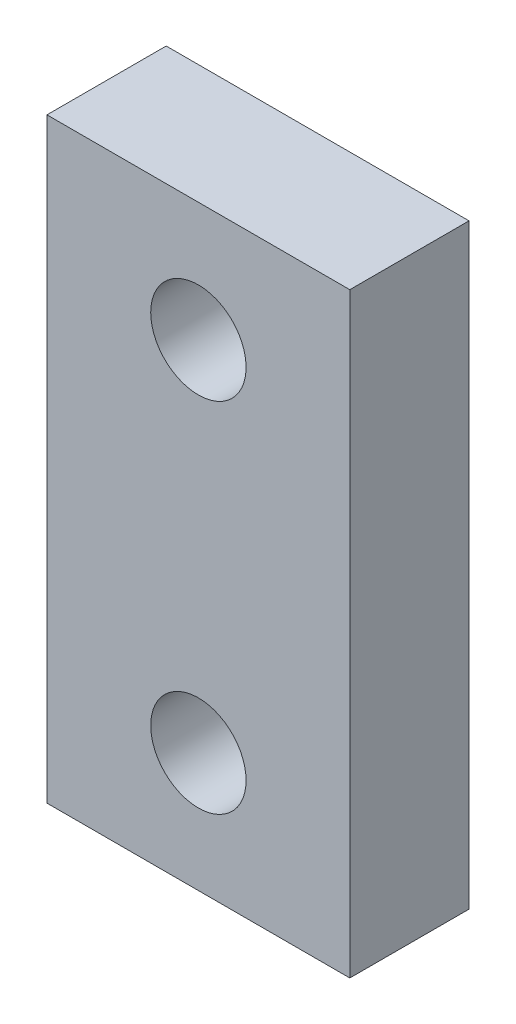
from build123d import *

# Parameters (mm, degrees)
SKETCH1_W           = 12.7
SKETCH1_H           = 25
SKETCH1_R           = 2
BOSS_EXTRUDE1_DEPTH = 5


with BuildPart() as part:
    # Sketch1 → Boss-Extrude1 (new body)
    with BuildSketch(Plane.XY):
        Rectangle(SKETCH1_W, SKETCH1_H)
        with Locations((0, -7.5)):
            Circle(SKETCH1_R, mode=Mode.SUBTRACT)
        with Locations(Location((0, 7.5, 0), (0, 0, 180))):
            Circle(SKETCH1_R, mode=Mode.SUBTRACT)
    extrude(amount=BOSS_EXTRUDE1_DEPTH)


solid = part.part
